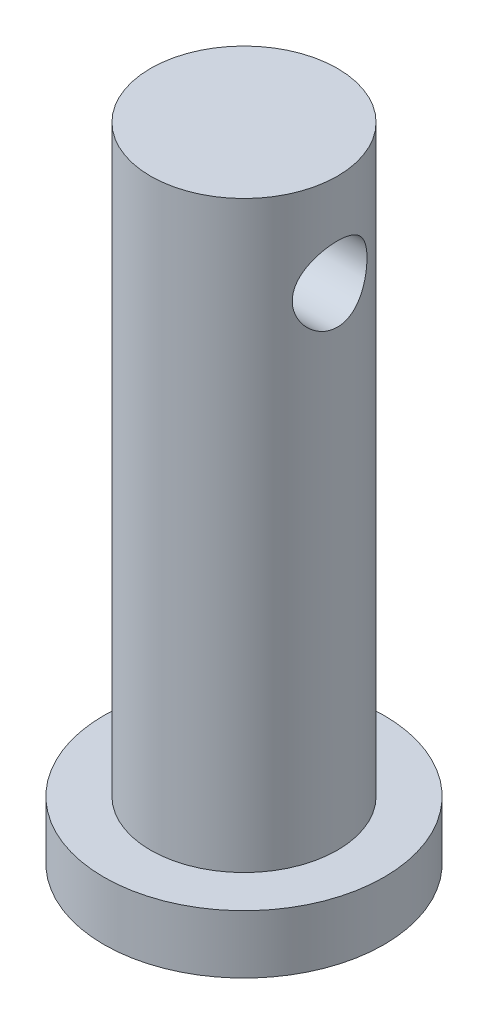
from build123d import *

# Parameters (mm, degrees)
SKETCH_1_R               = 6
EXTRUDE_1_DEPTH          = 2.5
SKETCH_2_R               = 4
EXTRUDE_2_DEPTH          = 25
CUT_EXTRUDE_1_DEPTH      = 29.779332862
CUT_EXTRUDE_1_DEPTH_BACK = 29.779332862
SKETCH_3_R               = 1.6


with BuildPart() as part:
    # 草图1 → 凸台-拉伸1 (new body)
    with BuildSketch(Plane(origin=(0, 0, 0), x_dir=(1, 0, 0), z_dir=(0, 1, 0))):
        with Locations(Location((0, 0, 0), (0, 0, 270))):
            Circle(SKETCH_1_R)
    extrude(amount=EXTRUDE_1_DEPTH)

    # 草图2 → 凸台-拉伸2 (add)
    with BuildSketch(Plane(origin=(0, 2.5, 0), x_dir=(1, 0, 0), z_dir=(0, 1, 0))):
        with Locations(Location((0, 0, 0), (0, 0, 270))):
            Circle(SKETCH_2_R)
    extrude(amount=EXTRUDE_2_DEPTH)

    # 草图3 → 切除-拉伸1 (cut, two sides: drawn at the far end of the back side and taken through both)
    with BuildSketch(Plane(origin=(0, 0, 0), x_dir=(0, 0, -1), z_dir=(1, 0, 0)).offset(-CUT_EXTRUDE_1_DEPTH_BACK)):
        with Locations((0, 23.5)):
            Circle(SKETCH_3_R)
    extrude(amount=CUT_EXTRUDE_1_DEPTH + CUT_EXTRUDE_1_DEPTH_BACK, mode=Mode.SUBTRACT)


solid = part.part
